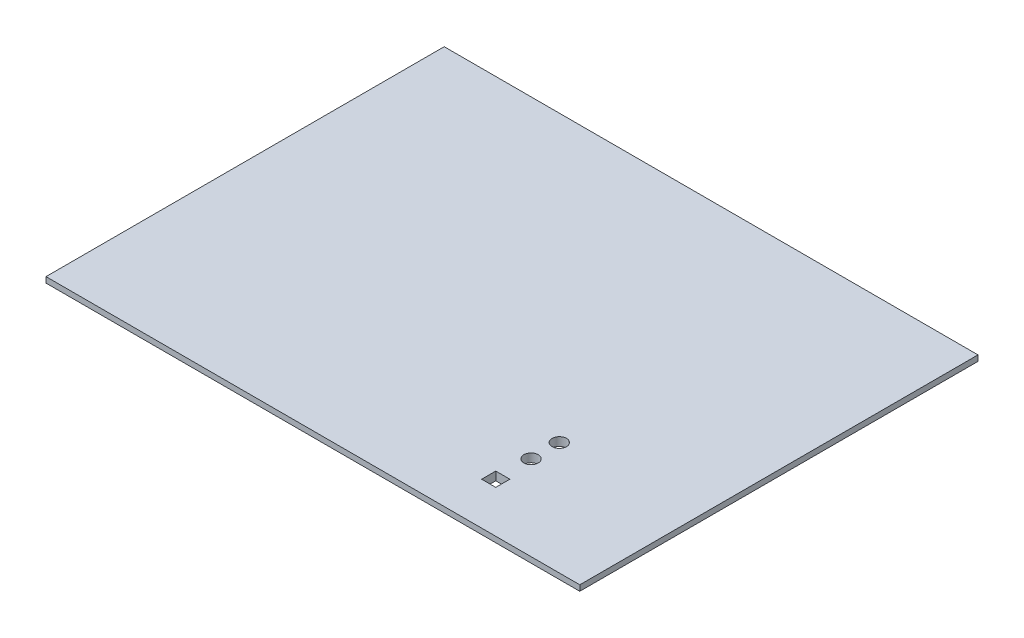
from build123d import *

# Parameters (mm, degrees)
ESBO_O1_W                = 179.9
ESBO_O1_H                = 131.9
RESSALTO_EXTRUS_O1_DEPTH = 1
ESBO_O2_W                = 189
ESBO_O2_H                = 141
RESSALTO_EXTRUS_O2_DEPTH = 2
ESBO_O3_R                = 2.55
ESBO_O3_W                = 5
ESBO_O3_H                = 5
CORTE_EXTRUS_O1_DEPTH    = 118.938543318


with BuildPart() as part:
    # Esboço1 → Ressalto-extrusão1 (new body)
    with BuildSketch(Plane(origin=(0, 0, 0), x_dir=(1, 0, 0), z_dir=(0, 1, 0))):
        Rectangle(ESBO_O1_W, ESBO_O1_H)
    extrude(amount=RESSALTO_EXTRUS_O1_DEPTH)

    # Esboço2 → Ressalto-extrusão2 (add)
    with BuildSketch(Plane(origin=(0, 1, 0), x_dir=(1, 0, 0), z_dir=(0, 1, 0))):
        Rectangle(ESBO_O2_W, ESBO_O2_H)
    extrude(amount=RESSALTO_EXTRUS_O2_DEPTH)

    # Esboço3 → Corte-extrusão1 (cut, through all)
    with BuildSketch(Plane(origin=(0, 3, 0), x_dir=(1, 0, 0), z_dir=(0, 1, 0))):
        with Locations(Location((47.25, -40.5, 0), (0, 0, 270))):
            Circle(ESBO_O3_R)
        with Locations(Location((47.25, -30.5, 0), (0, 0, 270))):
            Circle(ESBO_O3_R)
        with Locations((47.25, -53)):
            Rectangle(ESBO_O3_W, ESBO_O3_H)
    extrude(amount=-CORTE_EXTRUS_O1_DEPTH, mode=Mode.SUBTRACT)


solid = part.part
